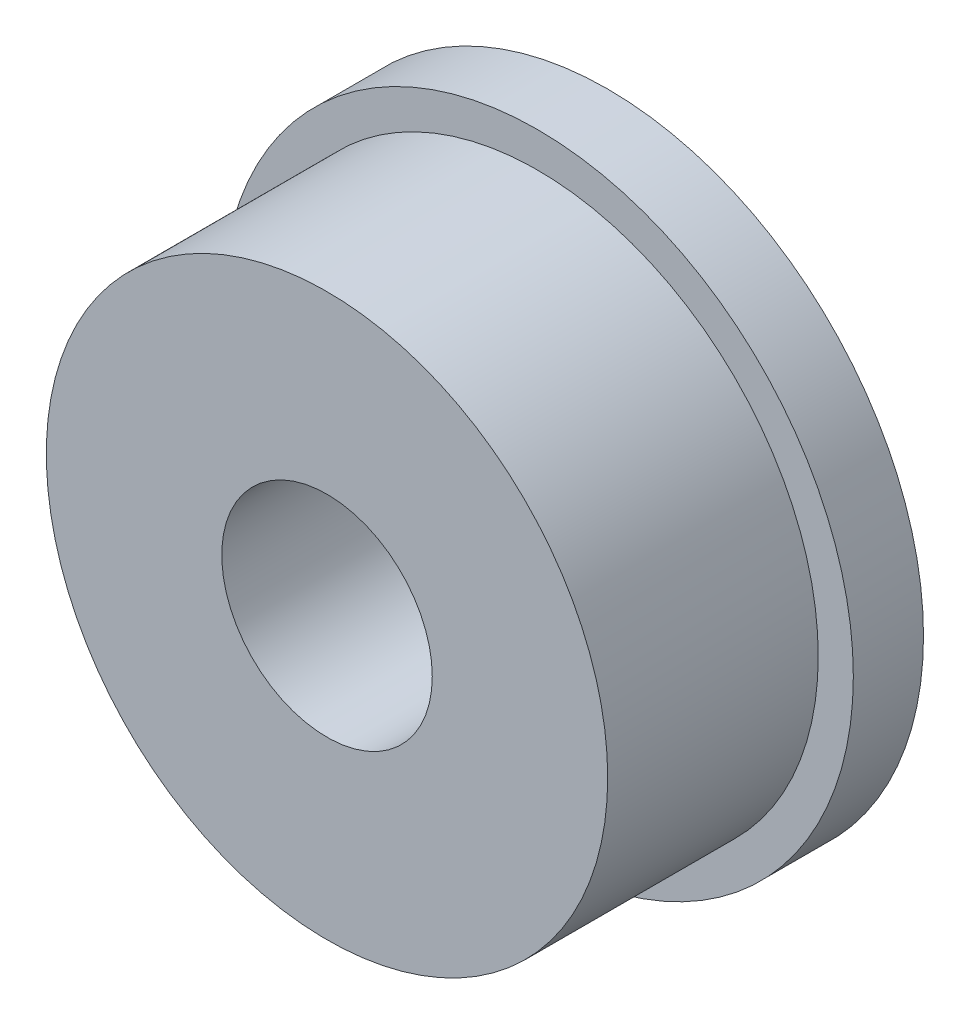
from build123d import *

# Parameters (mm, degrees)
SKETCH_1_R          = 4.5
EXTRUDE_1_DEPTH     = 1
SKETCH_2_R          = 4
EXTRUDE_2_DEPTH     = 3
SKETCH_3_R          = 1.5
CUT_EXTRUDE_1_DEPTH = 8.516648189


with BuildPart() as part:
    # 草图1 → 凸台-拉伸1 (new body)
    with BuildSketch(Plane.XY):
        Circle(SKETCH_1_R)
    extrude(amount=EXTRUDE_1_DEPTH)

    # 草图2 → 凸台-拉伸2 (add)
    with BuildSketch(Plane.XY.offset(1)):
        Circle(SKETCH_2_R)
    extrude(amount=EXTRUDE_2_DEPTH)

    # 草图3 → 切除-拉伸1 (cut, through all)
    with BuildSketch(Plane.XY.offset(4)):
        Circle(SKETCH_3_R)
    extrude(amount=-CUT_EXTRUDE_1_DEPTH, mode=Mode.SUBTRACT)


solid = part.part
